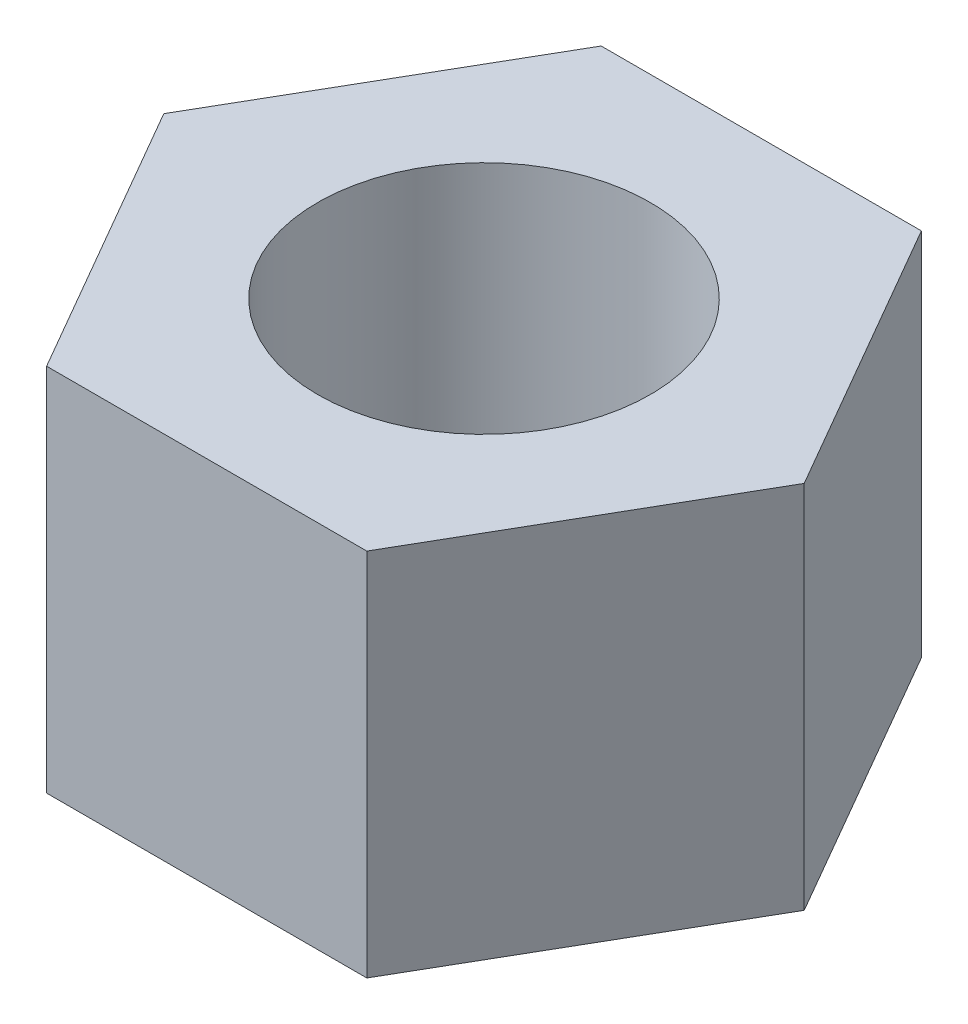
from build123d import *

# Parameters (mm, degrees)
SKETCH1_R           = 1.35
BOSS_EXTRUDE1_DEPTH = 1.5


with BuildPart() as part:
    # Sketch1 → Boss-Extrude1 (new, symmetric)
    with BuildSketch(Plane(origin=(0, 0, 0), x_dir=(1, 0, 0), z_dir=(0, 1, 0))):
        Polygon((1.299038106, 2.25), (-1.299038106, 2.25), (-2.598076211, 0), (-1.299038106, -2.25), (1.299038106, -2.25), (2.598076211, 0), align=None)
        with Locations(Location((0, 0, 0), (0, 0, 270))):
            Circle(SKETCH1_R, mode=Mode.SUBTRACT)
    extrude(amount=BOSS_EXTRUDE1_DEPTH, both=True)


solid = part.part
